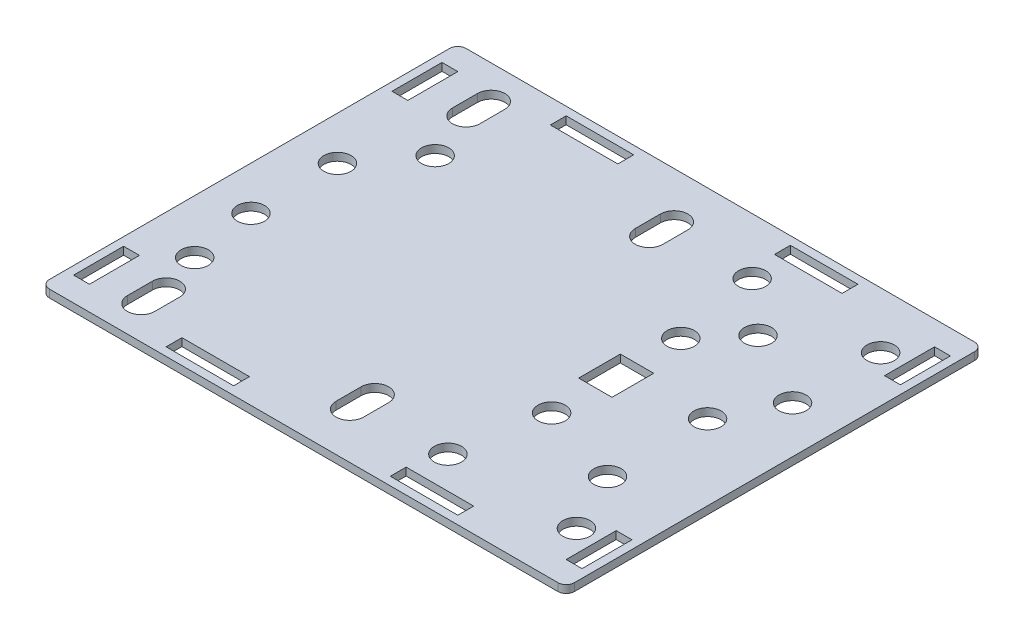
from build123d import *

# Parameters (mm, degrees)
SKETCH1_W                = 152.4
SKETCH1_H                = 127
BOSS_EXTRUDE1_DEPTH      = 2.3622
SKETCH9_R                = 4.15
CUT_EXTRUDE8_DEPTH       = 100.218294628
SKETCH16_R               = 4.15
CUT_EXTRUDE14_DEPTH      = 100.218294628
SKETCH26_W               = 10.16
SKETCH26_H               = 12.7
CUT_EXTRUDE26_DEPTH      = 100.218294628
SKETCH27_R               = 4.15
CUT_EXTRUDE27_DEPTH      = 100.218294628
SKETCH29_R               = 4.15
CUT_EXTRUDE28_DEPTH      = 100.218294628
SKETCH30_R               = 4.15
CUT_EXTRUDE29_DEPTH      = 100.218294628
SKETCH31_R               = 4.15
CUT_EXTRUDE30_DEPTH      = 100.218294628
SKETCH34_W               = 127
SKETCH34_H               = 2.3622
BOSS_EXTRUDE2_DEPTH      = 7.62
SKETCH38_W               = 88.9
SKETCH38_H               = 4.826
CUT_EXTRUDE34_DEPTH      = 7.62
SKETCH39_W               = 4.826
SKETCH39_H               = 15.24
CUT_EXTRUDE35_DEPTH      = 7.62
MIRROR15_COPY_1_SKETCH_W = 4.826
MIRROR15_COPY_1_SKETCH_H = 15.24
MIRROR15_COPY_1_DEPTH    = 7.62
CUT_EXTRUDE12_DEPTH      = 106.183755347
SKETCH40_W               = 47.752
SKETCH40_H               = 2.3622
BOSS_EXTRUDE3_DEPTH      = 4.826
FILLET2_R                = 2.54


with BuildPart() as part:
    # Sketch1 → Boss-Extrude1 (new body)
    with BuildSketch(Plane(origin=(0, 0, 0), x_dir=(1, 0, 0), z_dir=(0, 1, 0))):
        Rectangle(SKETCH1_W, SKETCH1_H)
    extrude(amount=BOSS_EXTRUDE1_DEPTH)

    # Sketch9 → Cut-Extrude8 (cut, through all)
    with BuildSketch(Plane.XZ):
        with Locations(Location((60.8584, 27.94, 0), (0, 0, 270))):
            Circle(SKETCH9_R)
        with Locations(Location((60.8584, -2.54, 0), (0, 0, 270))):
            Circle(SKETCH9_R)
    extrude(amount=-CUT_EXTRUDE8_DEPTH, mode=Mode.SUBTRACT)

    # Sketch16 → Cut-Extrude14 (cut, through all)
    with BuildSketch(Plane(origin=(0, 0, 0), x_dir=(-1, 0, 0), z_dir=(0, -1, 0))):
        with Locations(Location((-69.599893995, 19.704320306, 0), (0, 0, 90))):
            Circle(SKETCH16_R)
        with Locations(Location((-46.522565834, 32.264238523, 0), (0, 0, 90))):
            Circle(SKETCH16_R)
    extrude(amount=-CUT_EXTRUDE14_DEPTH, mode=Mode.SUBTRACT)

    # Sketch26 → Cut-Extrude26 (cut, through all)
    with BuildSketch(Plane(origin=(0, 2.3622, 0), x_dir=(1, 0, 0), z_dir=(0, 1, 0))):
        with Locations((35.56, 0)):
            Rectangle(SKETCH26_W, SKETCH26_H)
    extrude(amount=-CUT_EXTRUDE26_DEPTH, mode=Mode.SUBTRACT)

    # Sketch27 → Cut-Extrude27 (cut, through all)
    with BuildSketch(Plane.XZ):
        with Locations(Location((-59.831398438, 33.060447312, 0), (0, 0, 270))):
            Circle(SKETCH27_R)
        with Locations(Location((-50.09170874, -30.48, 0), (0, 0, 270))):
            Circle(SKETCH27_R)
    extrude(amount=-CUT_EXTRUDE27_DEPTH, mode=Mode.SUBTRACT)

    # Sketch29 → Cut-Extrude28 (cut, through all)
    with BuildSketch(Plane(origin=(0, 2.3622, 0), x_dir=(1, 0, 0), z_dir=(0, 1, 0))):
        with Locations(Location((35.56, 19.681240592, 0), (0, 0, 270))):
            Circle(SKETCH29_R)
        with Locations(Location((35.56, -19.681240592, 0), (0, 0, 270))):
            Circle(SKETCH29_R)
    extrude(amount=-CUT_EXTRUDE28_DEPTH, mode=Mode.SUBTRACT)

    # Sketch30 → Cut-Extrude29 (cut, through all)
    with BuildSketch(Plane(origin=(0, 2.3622, 0), x_dir=(1, 0, 0), z_dir=(0, 1, 0))):
        with Locations(Location((69.803274088, -46.355, 0), (0, 0, 270))):
            Circle(SKETCH30_R)
        with Locations(Location((30.63517528, -46.355, 0), (0, 0, 270))):
            Circle(SKETCH30_R)
    cut_extrude29 = extrude(amount=-CUT_EXTRUDE29_DEPTH, mode=Mode.SUBTRACT)

    # Mirror8: Cut-Extrude29 across plane
    add(cut_extrude29.mirror(Plane.XY), mode=Mode.SUBTRACT)

    # Sketch31 → Cut-Extrude30 (cut, through all)
    with BuildSketch(Plane(origin=(0, 2.3622, 0), x_dir=(1, 0, 0), z_dir=(0, 1, 0))):
        with Locations(Location((-62.942335235, -12.79551579, 0), (0, 0, 270))):
            Circle(SKETCH31_R)
        with Locations(Location((-62.942335235, 13.549600091, 0), (0, 0, 270))):
            Circle(SKETCH31_R)
    extrude(amount=-CUT_EXTRUDE30_DEPTH, mode=Mode.SUBTRACT)

    # Sketch34 → Boss-Extrude2 (add)
    with BuildSketch(Plane(origin=(76.2, 0, 0), x_dir=(0, 0, -1), z_dir=(1, 0, 0))):
        with Locations((0, 1.1811)):
            Rectangle(SKETCH34_W, SKETCH34_H)
    extrude(amount=BOSS_EXTRUDE2_DEPTH)

    # Sketch38 → Cut-Extrude34 (cut)
    with BuildSketch(Plane(origin=(0, 2.3622, 0), x_dir=(1, 0, 0), z_dir=(0, 1, 0))):
        with Locations((3.81, -58.547)):
            Rectangle(SKETCH38_W, SKETCH38_H)
    cut_extrude34 = extrude(amount=-CUT_EXTRUDE34_DEPTH, mode=Mode.SUBTRACT)

    # Mirror13: Cut-Extrude34 across plane
    add(cut_extrude34.mirror(Plane.XY), mode=Mode.SUBTRACT)

    # Sketch39 → Cut-Extrude35 (cut)
    with BuildSketch(Plane(origin=(0, 2.3622, 0), x_dir=(1, 0, 0), z_dir=(0, 1, 0))):
        with Locations((78.867, -48.514)):
            Rectangle(SKETCH39_W, SKETCH39_H)
    cut_extrude35 = extrude(amount=-CUT_EXTRUDE35_DEPTH, mode=Mode.SUBTRACT)

    # Mirror14: Cut-Extrude35 across plane
    add(cut_extrude35.mirror(Plane.XY), mode=Mode.SUBTRACT)

    # Mirror15: Cut-Extrude35 across plane
    add(cut_extrude35.mirror(Plane(origin=(3.81, 0, 0), x_dir=(0, 0, 1), z_dir=(1, 0, 0))), mode=Mode.SUBTRACT)

    # Mirror15 copy 1 sketch → Mirror15 copy 1 (cut)
    with BuildSketch(Plane(origin=(7.62, 2.3622, 0), x_dir=(-1, 0, 0), z_dir=(0, 1, 0))):
        with Locations((78.867, -48.514)):
            Rectangle(MIRROR15_COPY_1_SKETCH_W, MIRROR15_COPY_1_SKETCH_H)
    extrude(amount=-MIRROR15_COPY_1_DEPTH, mode=Mode.SUBTRACT)

    # Sketch13 → Cut-Extrude12 (cut, through all)
    with BuildSketch(Plane(origin=(0, 0, 0), x_dir=(-1, 0, 0), z_dir=(0, -1, 0))):
        with BuildLine():
            Line((60.052874771, -45.72), (60.052874771, -53.34))
            ThreePointArc((60.052874771, -53.34), (55.88, -57.512874771), (51.707125229, -53.34))
            Line((51.707125229, -53.34), (51.707125229, -45.72))
            ThreePointArc((51.707125229, -45.72), (55.88, -41.547125229), (60.052874771, -45.72))
        make_face()
        with BuildLine():
            Line((0.381, 49.403), (0.381, 41.783))
            ThreePointArc((0.381, 41.783), (-3.81, 37.592), (-8.001, 41.783))
            Line((-8.001, 41.783), (-8.001, 49.403))
            ThreePointArc((-8.001, 49.403), (-3.81, 53.594), (0.381, 49.403))
        make_face()
    cut_extrude12 = extrude(amount=-CUT_EXTRUDE12_DEPTH, mode=Mode.SUBTRACT)

    # Mirror16: Cut-Extrude12 across plane
    add(cut_extrude12.mirror(Plane.XY), mode=Mode.SUBTRACT)

    # Sketch40 → Boss-Extrude3 (add)
    with BuildSketch(Plane(origin=(0, 0, 60.96), x_dir=(-1, 0, 0), z_dir=(0, 0, -1))):
        with Locations((-3.81, 1.1811)):
            Rectangle(SKETCH40_W, SKETCH40_H)
    boss_extrude3 = extrude(amount=BOSS_EXTRUDE3_DEPTH)

    # Mirror17: Boss-Extrude3 across plane
    add(boss_extrude3.mirror(Plane.XY))

    # Fillet2
    fillet2_edges = [part.edges().sort_by_distance(p)[0] for p in [
        (83.82, 1.1811, -63.5),
        (-76.2, 1.1811, 63.5),
        (-76.2, 1.1811, -63.5),
        (83.82, 1.1811, 63.5),
    ]]
    fillet(fillet2_edges, radius=FILLET2_R)


solid = part.part
